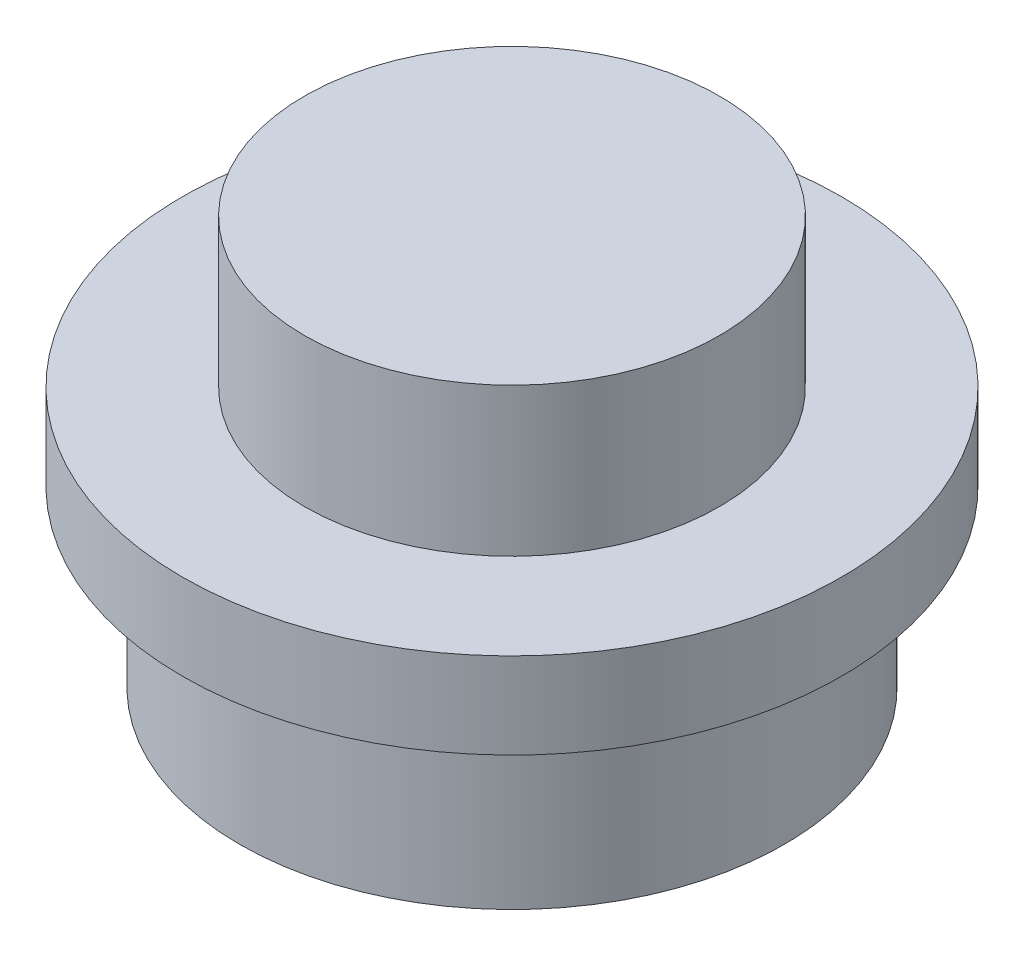
from build123d import *


with BuildPart() as part:
    # Sketch5 → Revolve1 (revolve)
    with BuildSketch(Plane.XY, mode=Mode.PRIVATE) as revolve1_sk:
        Polygon((0, 2.78), (2.465, 2.78), (2.465, 1.02), (3.915, 1.02), (3.915, 0), (3.235, 0), (3.235, -2.07), (2.445, -2.07), (2.445, 0), (1.345, 0), (1.345, 1.8), (0, 1.8), align=None)
    revolve(revolve1_sk.sketch.rotate(Axis((0, 3.061538462, 0), (0, -1, 0)), 90), axis=Axis((0, 3.061538462, 0), (0, -1, 0)))


solid = part.part
